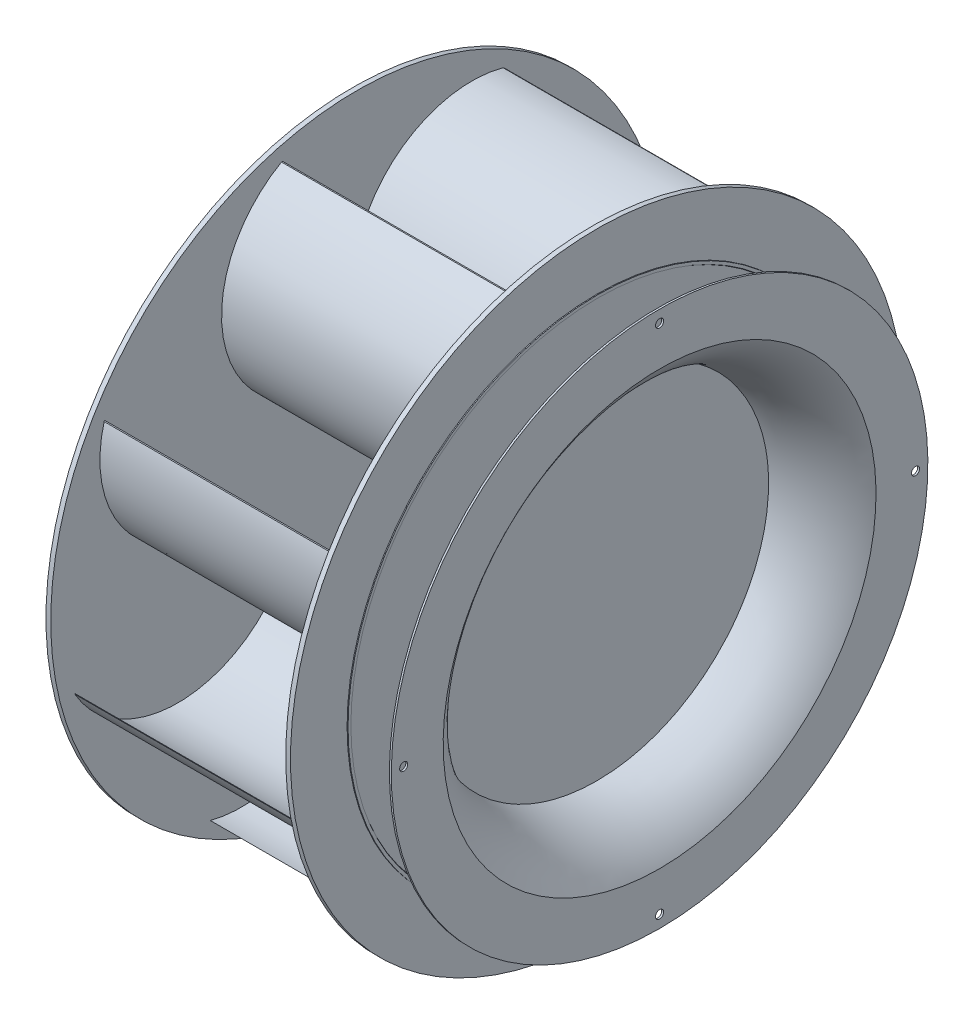
from build123d import *

# Parameters (mm, degrees)
SKETCH2_R         = 322
EXTRUDE1_DEPTH    = 5
SKETCH9_R         = 317
SKETCH9_R_2       = 100
EXTRUDE7_DEPTH    = 3
SKETCH3_R         = 322
EXTRUDE2_DEPTH    = 5
EXTRUDE3_DEPTH    = 252
CIRPATTERN1_COUNT = 8
SKETCH7_R         = 4.25
EXTRUDE5_DEPTH    = 5
CIRPATTERN2_COUNT = 4
SKETCH8_R         = 5
EXTRUDE6_DEPTH    = 90
CIRPATTERN3_COUNT = 8


with BuildPart() as part:
    # Sketch1 → Revolve1 (revolve)
    with BuildSketch(Plane.XY, mode=Mode.PRIVATE) as revolve1_sk:
        with BuildLine():
            Line((0, 0), (0, 109))
            ThreePointArc((0, 109), (1.464466094, 112.535533906), (5, 114))
            Line((5, 114), (70, 114))
            Line((70, 114), (70, 138))
            Line((70, 138), (90, 138))
            Line((90, 138), (90, 98))
            Line((90, 98), (95, 98))
            Line((95, 98), (95, 133))
            Line((95, 133), (105, 133))
            Line((105, 133), (105, 98))
            Line((105, 98), (129, 98))
            Line((129, 98), (129, 0))
            Line((129, 0), (0, 0))
        make_face()
    revolve(revolve1_sk.sketch.rotate(Axis((0, 0, 0), (1, 0, 0)), 90), axis=Axis((0, 0, 0), (1, 0, 0)))

    # Sketch2 → Extrude1 (add)
    with BuildSketch(Plane(origin=(129, 0, 0), x_dir=(0, 0, -1), z_dir=(1, 0, 0))):
        Circle(SKETCH2_R)
    extrude(amount=EXTRUDE1_DEPTH)

    # Sketch9 → Extrude7 (cut)
    with BuildSketch(Plane.ZY.offset(-129)):
        Circle(SKETCH9_R)
        Circle(SKETCH9_R_2, mode=Mode.SUBTRACT)
    extrude(amount=-EXTRUDE7_DEPTH, mode=Mode.SUBTRACT)



with BuildPart() as body_2:
    # Sketch3 → Extrude2 (new body)
    with BuildSketch(Plane(origin=(381, 0, 0), x_dir=(0, 0, -1), z_dir=(1, 0, 0))):
        Circle(SKETCH3_R)
    extrude(amount=EXTRUDE2_DEPTH)


with BuildPart() as part_1:
    add(part.part)

    add(body_2.part)  # Extrude3 merges body 2
    # Sketch4 → Extrude3 (add)
    with BuildSketch(Plane(origin=(134, 0, 0), x_dir=(0, 0, -1), z_dir=(1, 0, 0))):
        with BuildLine():
            Line((0, 112.5), (0.866025404, 112))
            ThreePointArc((0.866025404, 112), (33.143390798, 233.195288477), (154.366025404, 265.369798962))
            Line((154.366025404, 265.369798962), (153.5, 265.869798962))
            ThreePointArc((153.5, 265.869798962), (32.277365394, 233.695288477), (0, 112.5))
        make_face()
    extrude3 = extrude(amount=EXTRUDE3_DEPTH)

    # CirPattern1: Extrude3 ×8 about axis
    cirpattern1_axis = Axis((0, 0, 0), (1, 0, 0))
    for i in range(1, CIRPATTERN1_COUNT):
        add(extrude3.rotate(cirpattern1_axis, i * 360 / CIRPATTERN1_COUNT))

    # Sketch5 → Revolve2 (revolve)
    with BuildSketch(Plane.XY, mode=Mode.PRIVATE) as revolve2_sk:
        with BuildLine():
            Line((386, 262.5), (387, 262.5))
            Line((387, 262.5), (387, 259.5))
            ThreePointArc((387, 259.5), (357.709873819, 226.481482649), (354, 182.5))
            Line((354, 182.5), (354, 181.5))
            ThreePointArc((354, 181.5), (356.940142179, 225.857890388), (386, 259.5))
            Line((386, 259.5), (386, 262.5))
        make_face()
    revolve(revolve2_sk.sketch.rotate(Axis((0, 0, 0), (1, 0, 0)), 90), axis=Axis((0, 0, 0), (1, 0, 0)))

    # Sketch8 → Extrude6 (cut)
    with BuildSketch(Plane(origin=(0, 0, 0), x_dir=(0, 0, -1), z_dir=(1, 0, 0))):
        with Locations(Location((0, 126, 0), (0, 0, 180))):
            Circle(SKETCH8_R)
    extrude6 = extrude(amount=EXTRUDE6_DEPTH, mode=Mode.SUBTRACT)

    # CirPattern3: Extrude6 ×8 about axis
    cirpattern3_axis = Axis((0, 0, 0), (1, 0, 0))
    for i in range(1, CIRPATTERN3_COUNT):
        add(extrude6.rotate(cirpattern3_axis, i * 360 / CIRPATTERN3_COUNT), mode=Mode.SUBTRACT)


with BuildPart() as body_2_2:
    # Sketch6 → Revolve3 (revolve)
    with BuildSketch(Plane.XY, mode=Mode.PRIVATE) as revolve3_sk:
        with BuildLine():
            Line((452, 282), (450, 282))
            Line((450, 282), (450, 227.5))
            ThreePointArc((450, 227.5), (407.763122811, 190.091607925), (352, 181.5))
            Line((352, 181.5), (348, 181.5))
            Line((348, 181.5), (348, 179.5))
            Line((348, 179.5), (352, 179.5))
            ThreePointArc((352, 179.5), (409.265305263, 188.363947369), (452, 227.5))
            Line((452, 227.5), (452, 282))
        make_face()
    revolve(revolve3_sk.sketch.rotate(Axis((0, 0, 0), (1, 0, 0)), 180), axis=Axis((0, 0, 0), (1, 0, 0)))

    # Sketch7 → Extrude5 (cut)
    with BuildSketch(Plane(origin=(452, 0, 0), x_dir=(0, 0, -1), z_dir=(1, 0, 0))):
        with Locations((0, 269)):
            Circle(SKETCH7_R)
    extrude5 = extrude(amount=-EXTRUDE5_DEPTH, mode=Mode.SUBTRACT)

    # CirPattern2: Extrude5 ×4 about axis
    cirpattern2_axis = Axis((0, 0, 0), (1, 0, 0))
    for i in range(1, CIRPATTERN2_COUNT):
        add(extrude5.rotate(cirpattern2_axis, i * 360 / CIRPATTERN2_COUNT), mode=Mode.SUBTRACT)


solid = Compound([part_1.part, body_2_2.part])
